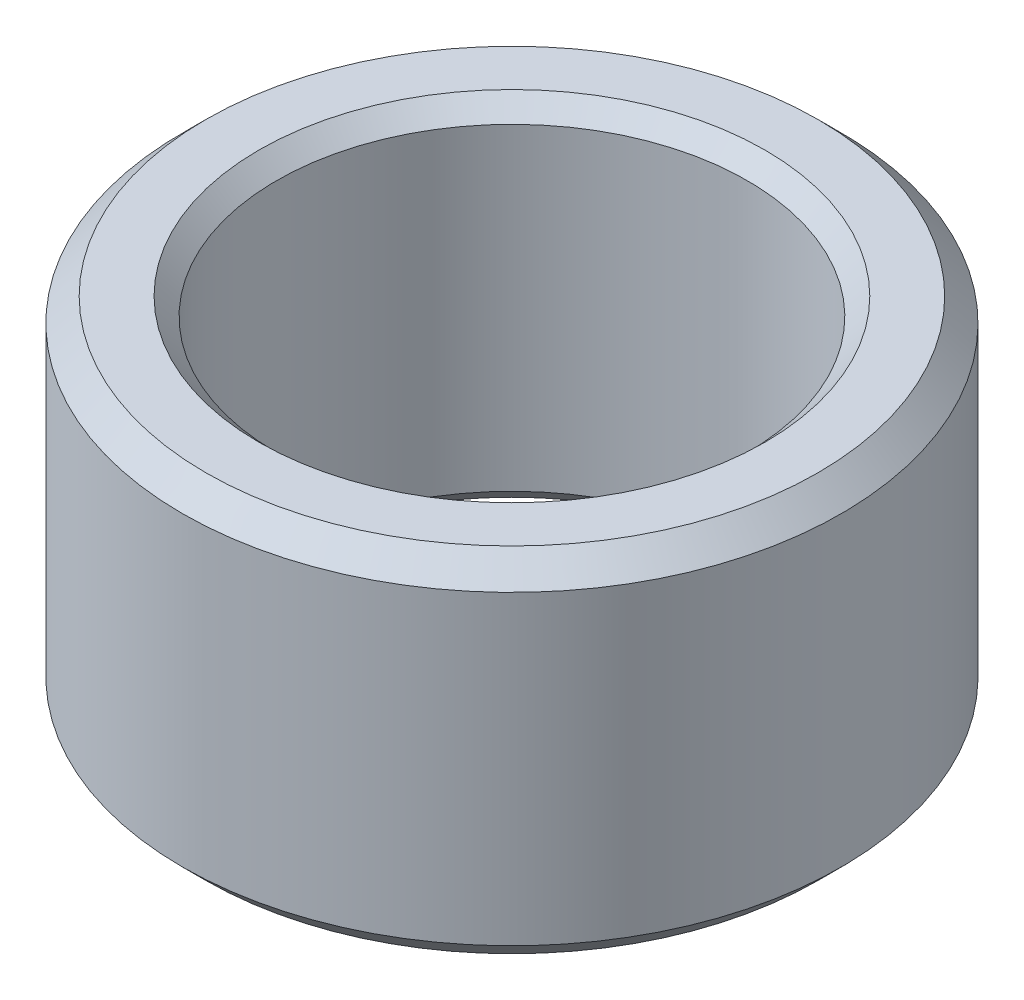
from build123d import *

# Parameters (mm, degrees)
SKETCH_1_R      = 5.6
SKETCH_1_R_2    = 4
EXTRUDE_1_DEPTH = 6
CHAMFER_1_SIZE  = 0.3
CHAMFER_2_SIZE  = 0.4


with BuildPart() as part:
    # Эскиз1 → Бобышка-Вытянуть1 (new body)
    with BuildSketch(Plane(origin=(0, 0, 0), x_dir=(1, 0, 0), z_dir=(0, 1, 0))):
        with Locations(Location((0, 0, 0), (0, 0, 270))):
            Circle(SKETCH_1_R)
        with Locations(Location((0, 0, 0), (0, 0, 270))):
            Circle(SKETCH_1_R_2, mode=Mode.SUBTRACT)
    extrude(amount=EXTRUDE_1_DEPTH)

    # Фаска1
    chamfer_1_edges = [part.edges().sort_by_distance(p)[0] for p in [
        (0, 0, -4),
        (0, 6, -4),
    ]]
    chamfer(chamfer_1_edges, length=CHAMFER_1_SIZE)

    # Фаска2
    chamfer_2_edges = [part.edges().sort_by_distance(p)[0] for p in [
        (0, 0, -5.6),
        (0, 6, -5.6),
    ]]
    chamfer(chamfer_2_edges, length=CHAMFER_2_SIZE)


solid = part.part
